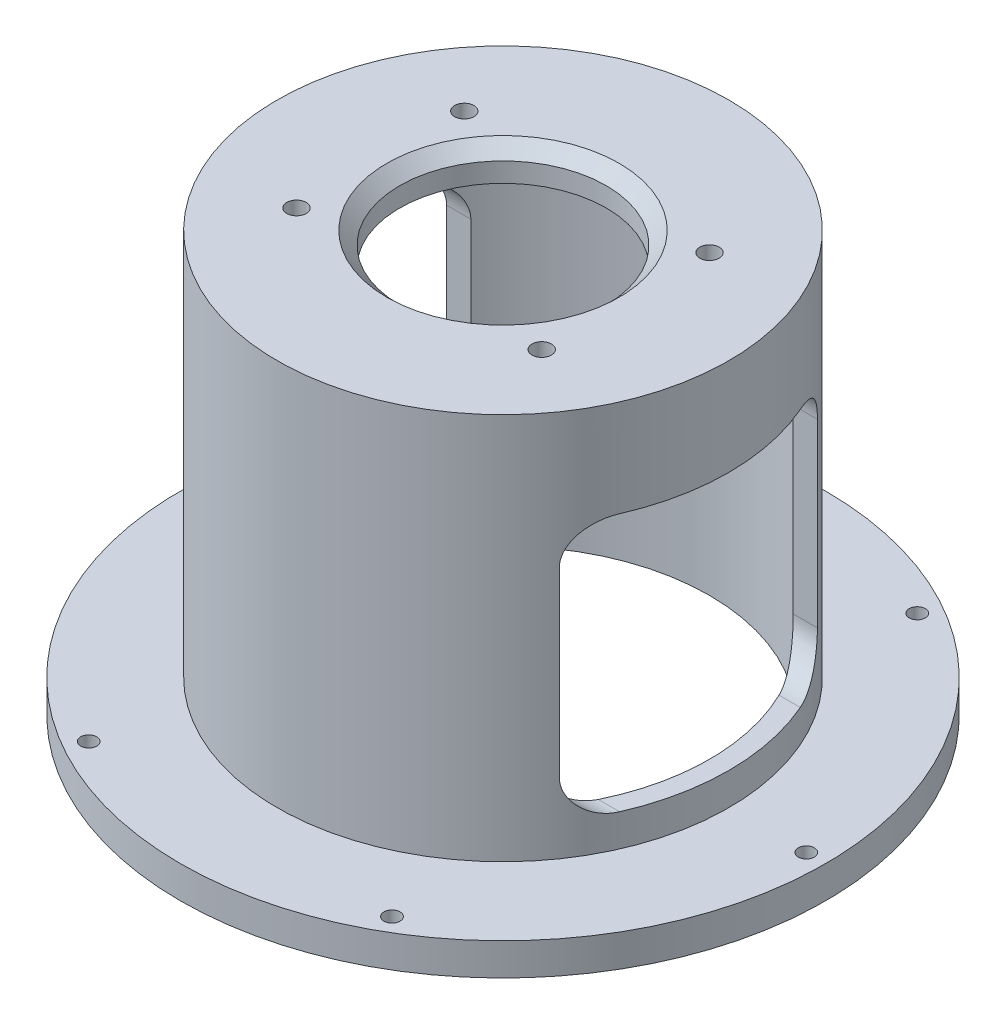
from build123d import *

# Parameters (mm, degrees)
CHAMFER_1_SIZE           = 2
HOLE_WIZARD_M3_1_D       = 3
CUT_EXTRUDE_1_DEPTH      = 97.046863561
CUT_EXTRUDE_1_DEPTH_BACK = 97.046863561
HOLE_WIZARD_M3_1_2_D     = 2.5


with BuildPart() as part:
    # 草图1 → 旋转1 (revolve)
    with BuildSketch(Plane(origin=(0, 0, 0), x_dir=(0, 0, -1), z_dir=(1, 0, 0))):
        Polygon((32, 0), (50, 0), (50, 5), (35, 5), (35, 65), (16, 65), (16, 60), (32, 60), align=None)
    revolve(axis=Axis((0, 0, 0), (0, 1, 0)))

    # 倒角1
    chamfer_1_edges = [part.edges().sort_by_distance(p)[0] for p in [
        (0, 65, 16),
    ]]
    chamfer(chamfer_1_edges, length=CHAMFER_1_SIZE)

    # Hole Wizard M3 _1 (through all)
    with Locations(Plane(origin=(0, 65, 0), x_dir=(1, 0, 0), z_dir=(0, 1, 0))):
        with Locations((19, -13), (-19, 13), (-19, -13), (19, 13)):
            Hole(HOLE_WIZARD_M3_1_D / 2)

    # 草图4 → 切除-拉伸1 (cut, two sides: drawn at the far end of the back side and taken through both)
    with BuildSketch(Plane(origin=(0, 0, 0), x_dir=(0, 0, -1), z_dir=(1, 0, 0)).offset(-CUT_EXTRUDE_1_DEPTH_BACK)):
        with BuildLine():
            Line((-14, 10), (14, 10))
            ThreePointArc((14, 10), (18.242640687, 11.757359313), (20, 16))
            Line((20, 16), (20, 44))
            ThreePointArc((20, 44), (18.242640687, 48.242640687), (14, 50))
            Line((14, 50), (-14, 50))
            ThreePointArc((-14, 50), (-18.242640687, 48.242640687), (-20, 44))
            Line((-20, 44), (-20, 16))
            ThreePointArc((-20, 16), (-18.242640687, 11.757359313), (-14, 10))
        make_face()
    extrude(amount=CUT_EXTRUDE_1_DEPTH + CUT_EXTRUDE_1_DEPTH_BACK, mode=Mode.SUBTRACT)

    # Hole Wizard M3 _1 2 (through all)
    with Locations(Plane(origin=(0, 0, 0), x_dir=(-1, 0, 0), z_dir=(0, -1, 0))):
        with Locations((47, 0), (23.5, -40.703193978), (-23.5, -40.703193978), (-47, 0), (-23.5, 40.703193978), (23.5, 40.703193978)):
            Hole(HOLE_WIZARD_M3_1_2_D / 2)


solid = part.part
